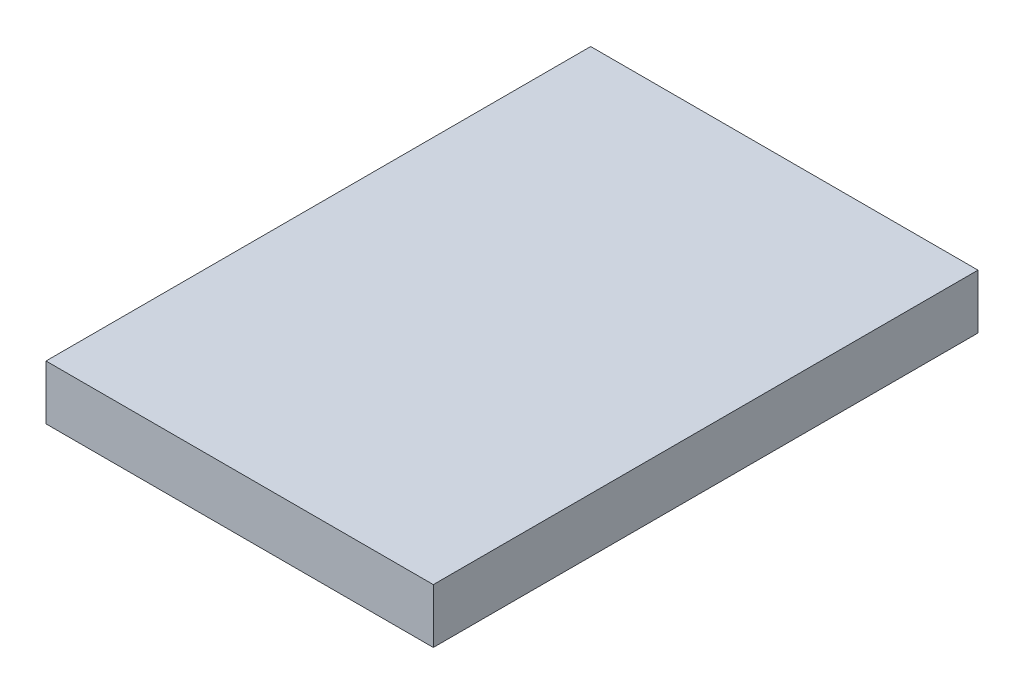
from build123d import *

# Parameters (mm, degrees)
SKETCH1_W           = 3.2
SKETCH1_H           = 4.5
BOSS_EXTRUDE1_DEPTH = 0.45


with BuildPart() as part:
    # Sketch1 → Boss-Extrude1 (new body)
    with BuildSketch(Plane(origin=(0, 0, 0), x_dir=(1, 0, 0), z_dir=(0, 1, 0))):
        with Locations((1.6, 2.25)):
            Rectangle(SKETCH1_W, SKETCH1_H)
    extrude(amount=BOSS_EXTRUDE1_DEPTH)


solid = part.part
